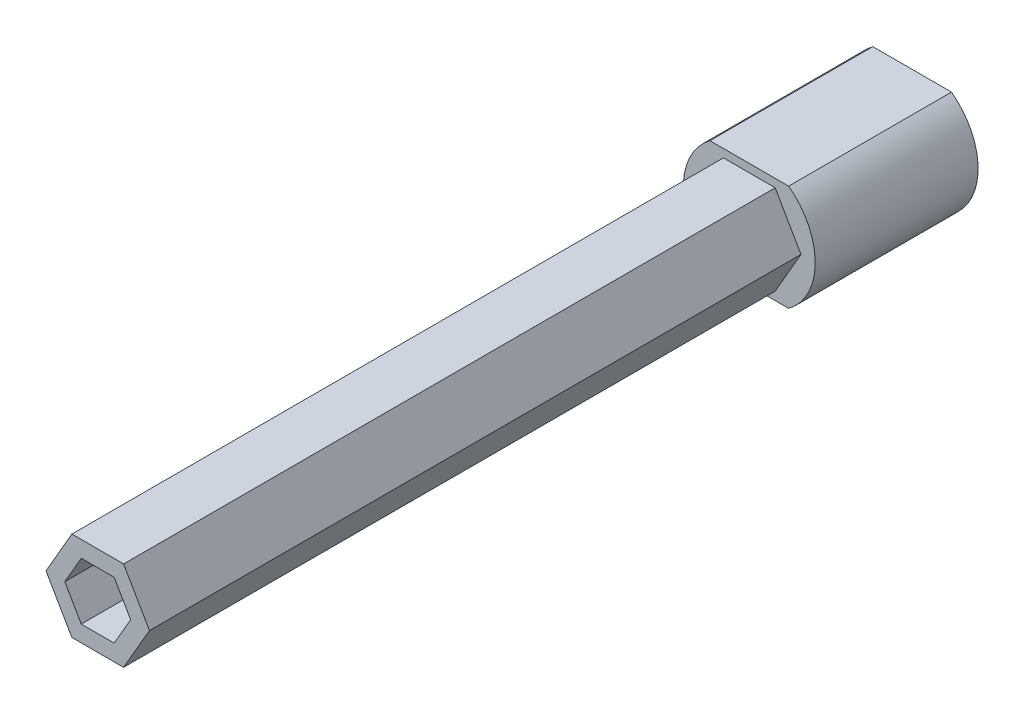
from build123d import *

# Parameters (mm, degrees)
BOSS_EXTRUDE2_DEPTH     = 10
CUT_EXTRUDE2_DEPTH      = 8
BOSS_EXTRUDE3_DEPTH     = 40
CUT_EXTRUDE3_DEPTH      = 51.268926784
CUT_EXTRUDE3_DEPTH_BACK = 51.268926784


with BuildPart() as part:
    # Sketch1 → Boss-Extrude2 (new body)
    with BuildSketch(Plane.XY):
        with BuildLine():
            Line((-2.416609195, 3.25), (2.416609195, 3.25))
            ThreePointArc((2.416609195, 3.25), (4.05, 0), (2.416609195, -3.25))
            Line((2.416609195, -3.25), (-2.416609195, -3.25))
            ThreePointArc((-2.416609195, -3.25), (-4.05, 0), (-2.416609195, 3.25))
        make_face()
    extrude(amount=BOSS_EXTRUDE2_DEPTH)

    # Sketch3 → Cut-Extrude2 (cut)
    with BuildSketch(Plane(origin=(0, 0, 0), x_dir=(-1, 0, 0), z_dir=(0, 0, -1))):
        with BuildLine():
            Line((2.059126028, 2.25), (-2.059126028, 2.25))
            ThreePointArc((-2.059126028, 2.25), (-3.05, 0), (-2.059126028, -2.25))
            Line((-2.059126028, -2.25), (2.059126028, -2.25))
            ThreePointArc((2.059126028, -2.25), (3.05, 0), (2.059126028, 2.25))
        make_face()
    extrude(amount=-CUT_EXTRUDE2_DEPTH, mode=Mode.SUBTRACT)

    # Sketch4 → Boss-Extrude3 (add)
    with BuildSketch(Plane.XY.offset(10)):
        Polygon((1.586062627, -2.750952322), (3.175425909, -0.001905634), (1.589363281, 2.749046688), (-1.586062627, 2.750952322), (-3.175425909, 0.001905634), (-1.589363281, -2.749046688), align=None)
    extrude(amount=BOSS_EXTRUDE3_DEPTH)

    # Sketch5 → Cut-Extrude3 (cut, two sides: drawn at the far end of the back side and taken through both)
    with BuildSketch(Plane.XY.offset(50).offset(-CUT_EXTRUDE3_DEPTH_BACK)):
        Polygon((-1.011412997, -1.749393347), (1.009312581, -1.750606023), (2.020725578, -0.001212676), (1.011412997, 1.749393347), (-1.009312581, 1.750606023), (-2.020725578, 0.001212676), align=None)
    extrude(amount=CUT_EXTRUDE3_DEPTH + CUT_EXTRUDE3_DEPTH_BACK, mode=Mode.SUBTRACT)


solid = part.part
